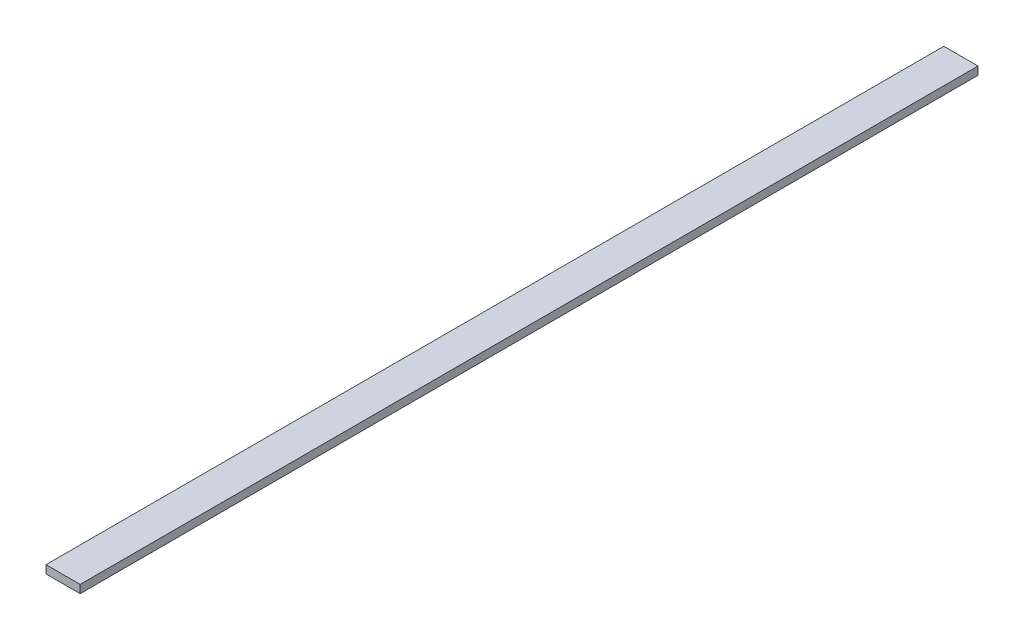
from build123d import *

# Parameters (mm, degrees)
CROQUIS1_W              = 12.7
CROQUIS1_H              = 3
SALIENTE_EXTRUIR1_DEPTH = 167


with BuildPart() as part:
    # Croquis1 → Saliente-Extruir1 (new, symmetric)
    with BuildSketch(Plane.XY):
        Rectangle(CROQUIS1_W, CROQUIS1_H)
    extrude(amount=SALIENTE_EXTRUIR1_DEPTH, both=True)


solid = part.part
